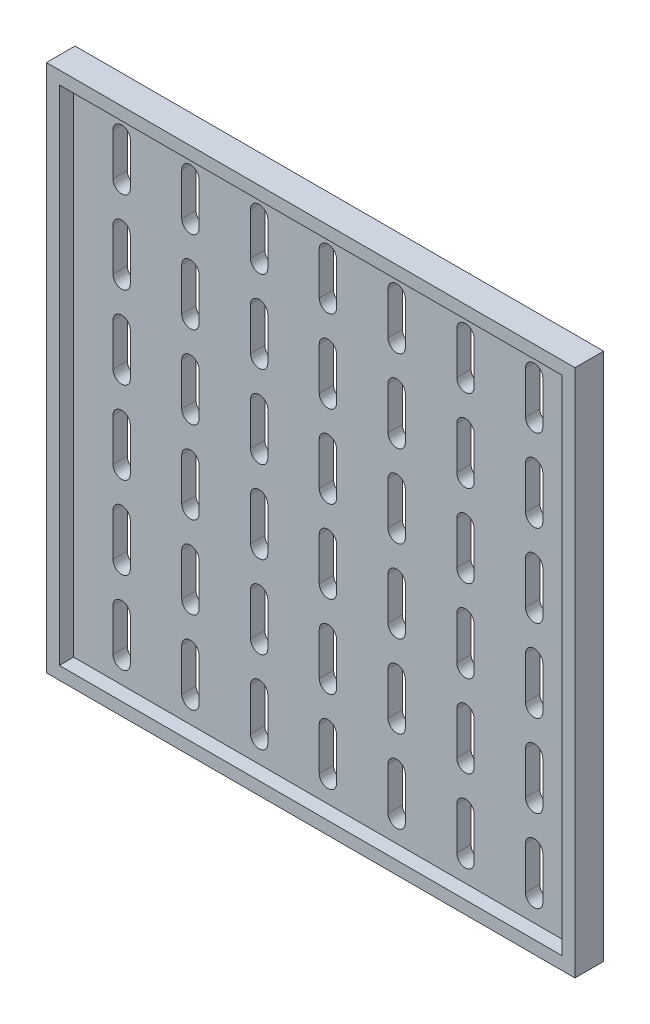
from build123d import *

# Parameters (mm, degrees)
SKETCH1_W            = 73.8
SKETCH1_H            = 73.8
BOSS_EXTRUDE1_DEPTH  = 2
SKETCH1_3_W          = 73.8
SKETCH1_3_H          = 73.8
SKETCH1_3_W_2        = 70.2
SKETCH1_3_H_2        = 70.2
BOSS_EXTRUDE2_DEPTH  = 4
CUT_EXTRUDE1_DEPTH   = 4
LPATTERN1_COUNT      = 7
LPATTERN1_PITCH      = 9.6
LPATTERN1_COUNT_DIR2 = 6
LPATTERN1_PITCH_DIR2 = 11.5


with BuildPart() as part:
    # Sketch1 → Boss-Extrude1 (new body)
    with BuildSketch(Plane.XY):
        with Locations((-4.391761132, -11.056981132)):
            Rectangle(SKETCH1_W, SKETCH1_H)
    extrude(amount=BOSS_EXTRUDE1_DEPTH)

    # Sketch1<3> → Boss-Extrude2 (add)
    with BuildSketch(Plane.XY):
        with Locations((-4.391761132, -11.056981132)):
            Rectangle(SKETCH1_3_W, SKETCH1_3_H)
        with Locations((-4.391761132, -11.056981132)):
            Rectangle(SKETCH1_3_W_2, SKETCH1_3_H_2, mode=Mode.SUBTRACT)
    extrude(amount=BOSS_EXTRUDE2_DEPTH)

    # Sketch2 → Cut-Extrude1 (cut)
    with BuildSketch(Plane(origin=(0, 0, 0), x_dir=(-1, 0, 0), z_dir=(0, 0, -1))):
        with BuildLine():
            Line((-23.60494091, 20.343241551), (-23.60494091, 14.414528177))
            ThreePointArc((-23.60494091, 14.414528177), (-24.812641783, 13.206827304), (-26.020342655, 14.414528177))
            Line((-26.020342655, 14.414528177), (-26.020342655, 20.343241551))
            ThreePointArc((-26.020342655, 20.343241551), (-24.812641783, 21.550942423), (-23.60494091, 20.343241551))
        make_face()
    cut_extrude1 = extrude(amount=-CUT_EXTRUDE1_DEPTH, mode=Mode.SUBTRACT)

    # LPattern1: Cut-Extrude1 7 × 6
    with Locations(*[(-i * LPATTERN1_PITCH, -j * LPATTERN1_PITCH_DIR2, 0) for i in range(LPATTERN1_COUNT) for j in range(LPATTERN1_COUNT_DIR2) if (i, j) != (0, 0)]):
        add(cut_extrude1, mode=Mode.SUBTRACT)


solid = part.part
